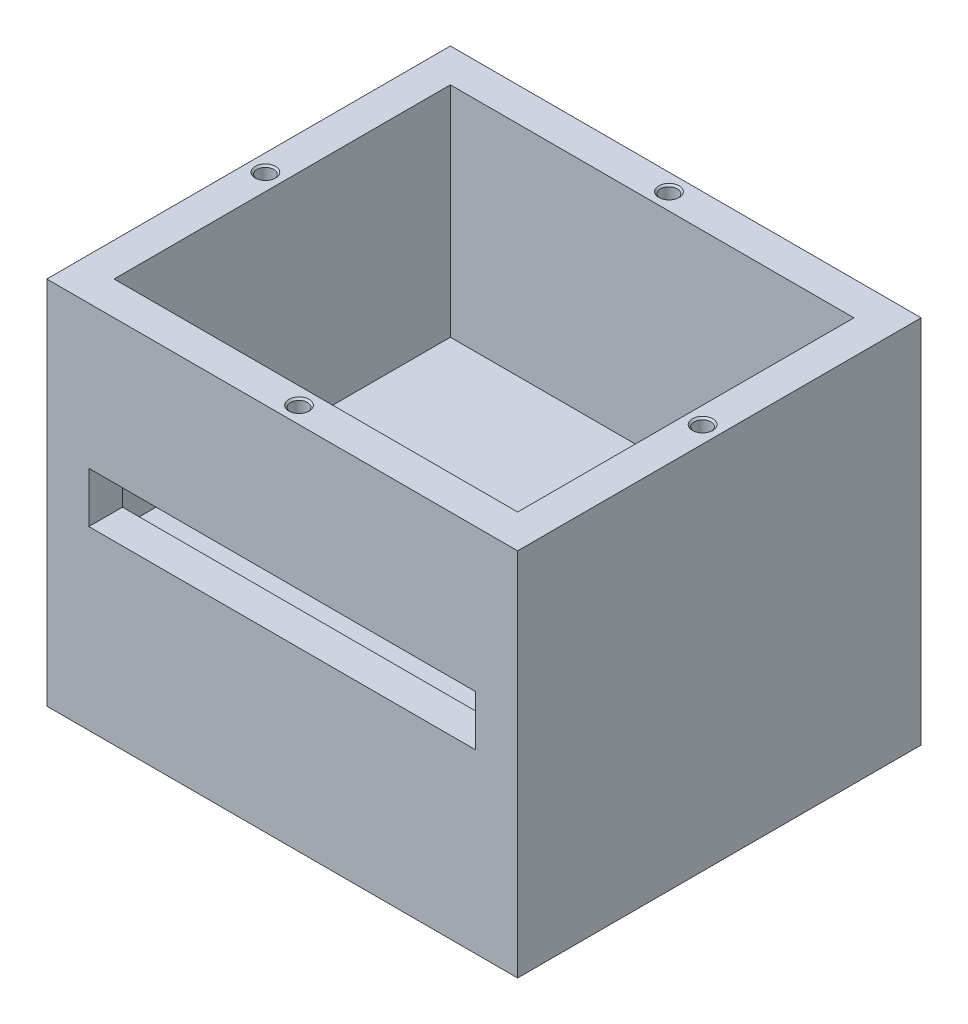
from build123d import *

# Parameters (mm, degrees)
BOX_TOP_VIEW_W                 = 140
BOX_TOP_VIEW_H                 = 120
BOX_EXTRUDE_PART_DEPTH         = 110
INNER_BOX_CUT_W                = 120
INNER_BOX_CUT_H                = 100
INNER_BOX_CUT_1_DEPTH          = 65
SCISSOR_CROSSSECTION_W         = 115
SCISSOR_CROSSSECTION_H         = 15
SCISSOR_CORSSSECTION_CUT_DEPTH = 10
SHAFT_LOCATION_R               = 7.5
SHAFT_LOCATION_CUT_DEPTH       = 35
SKETCH2_R                      = 14
CUT_EXTRUDE2_DEPTH             = 10
M6_TAPPED_HOLE3_AT_2_COUNT     = 2
M6_TAPPED_HOLE3_AT_2_PITCH     = 85.14693183


with BuildPart() as part:
    # Box_top_view → Box_extrude_part (new body)
    with BuildSketch(Plane(origin=(0, 0, 0), x_dir=(1, 0, 0), z_dir=(0, 1, 0))):
        Rectangle(BOX_TOP_VIEW_W, BOX_TOP_VIEW_H)
    extrude(amount=BOX_EXTRUDE_PART_DEPTH)

    # Inner_box_cut → Inner_box_cut_1 (cut)
    with BuildSketch(Plane(origin=(0, 110, 0), x_dir=(1, 0, 0), z_dir=(0, 1, 0))):
        Rectangle(INNER_BOX_CUT_W, INNER_BOX_CUT_H)
    extrude(amount=-INNER_BOX_CUT_1_DEPTH, mode=Mode.SUBTRACT)

    # Scissor_crossSection → Scissor_corssSection_cut (cut)
    with BuildSketch(Plane.XY.offset(60)):
        with Locations((0, 60)):
            Rectangle(SCISSOR_CROSSSECTION_W, SCISSOR_CROSSSECTION_H)
    extrude(amount=-SCISSOR_CORSSSECTION_CUT_DEPTH, mode=Mode.SUBTRACT)

    # Shaft_location → Shaft_location_cut (cut)
    with BuildSketch(Plane(origin=(0, 45, 0), x_dir=(1, 0, 0), z_dir=(0, 1, 0))):
        with Locations(Location((15, 0, 0), (0, 0, 270))):
            Circle(SHAFT_LOCATION_R)
        with Locations(Location((-15, 0, 0), (0, 0, 90))):
            Circle(SHAFT_LOCATION_R)
    extrude(amount=-SHAFT_LOCATION_CUT_DEPTH, mode=Mode.SUBTRACT)

    # Sketch2 → Cut-Extrude2 (cut)
    with BuildSketch(Plane(origin=(0, 45, 0), x_dir=(1, 0, 0), z_dir=(0, 1, 0))):
        with Locations(Location((-15, 0, 0), (0, 0, 270))):
            Circle(SKETCH2_R)
        with Locations(Location((15, 0, 0), (0, 0, 90))):
            Circle(SKETCH2_R)
    extrude(amount=-CUT_EXTRUDE2_DEPTH, mode=Mode.SUBTRACT)

    # Sketch7 → M6 Tapped Hole3 (revolve, cut)
    with BuildSketch(Plane(origin=(0, 110, -55), x_dir=(0, 0, 1), z_dir=(1, 0, 0))):
        Polygon((0, 0), (0, 14.502151548), (2.5, 13), (2.5, 0.525), (3.025, 0), align=None)
    m6_tapped_hole3 = revolve(axis=Axis((0, 116.35, -55), (0, -1, 0)), mode=Mode.SUBTRACT)

    # M6 Tapped Hole3 at 2: M6 Tapped Hole3 ×2
    with Locations(*[Vector(-0.7633862853691146, 0, 0.645942241466174) * (i * M6_TAPPED_HOLE3_AT_2_PITCH) for i in range(1, M6_TAPPED_HOLE3_AT_2_COUNT)]):
        add(m6_tapped_hole3, mode=Mode.SUBTRACT)

    # M6_hole_mirror: M6 Tapped Hole3 across plane
    add(m6_tapped_hole3.mirror(Plane(origin=(0, 0, 0), x_dir=(0, 0, 1), z_dir=(1, 0, 0))), mode=Mode.SUBTRACT)

    # M6_hole_mirror copy 1 sketch → M6_hole_mirror copy 1 (revolve, cut)
    with BuildSketch(Plane(origin=(65, 110, 0), x_dir=(0, 0, 1), z_dir=(-1, 0, 0))):
        Polygon((0, 0), (0, -14.502151548), (2.5, -13), (2.5, -0.525), (3.025, 0), align=None)
    revolve(axis=Axis((65, 116.35, 0), (0, 1, 0)), mode=Mode.SUBTRACT)

    # M6_hole_mirror at the second plane: M6 Tapped Hole3 across plane
    add(m6_tapped_hole3.mirror(Plane.XY), mode=Mode.SUBTRACT)

    # M6_hole_mirror at the second plane copy → M6_hole_mirror at the second plane c 2 (revolve, cut)
    with BuildSketch(Plane(origin=(-65, 110, 0), x_dir=(0, 0, -1), z_dir=(1, 0, 0))):
        Polygon((0, 0), (0, -14.502151548), (2.5, -13), (2.5, -0.525), (3.025, 0), align=None)
    revolve(axis=Axis((-65, 116.35, 0), (0, 1, 0)), mode=Mode.SUBTRACT)


solid = part.part
